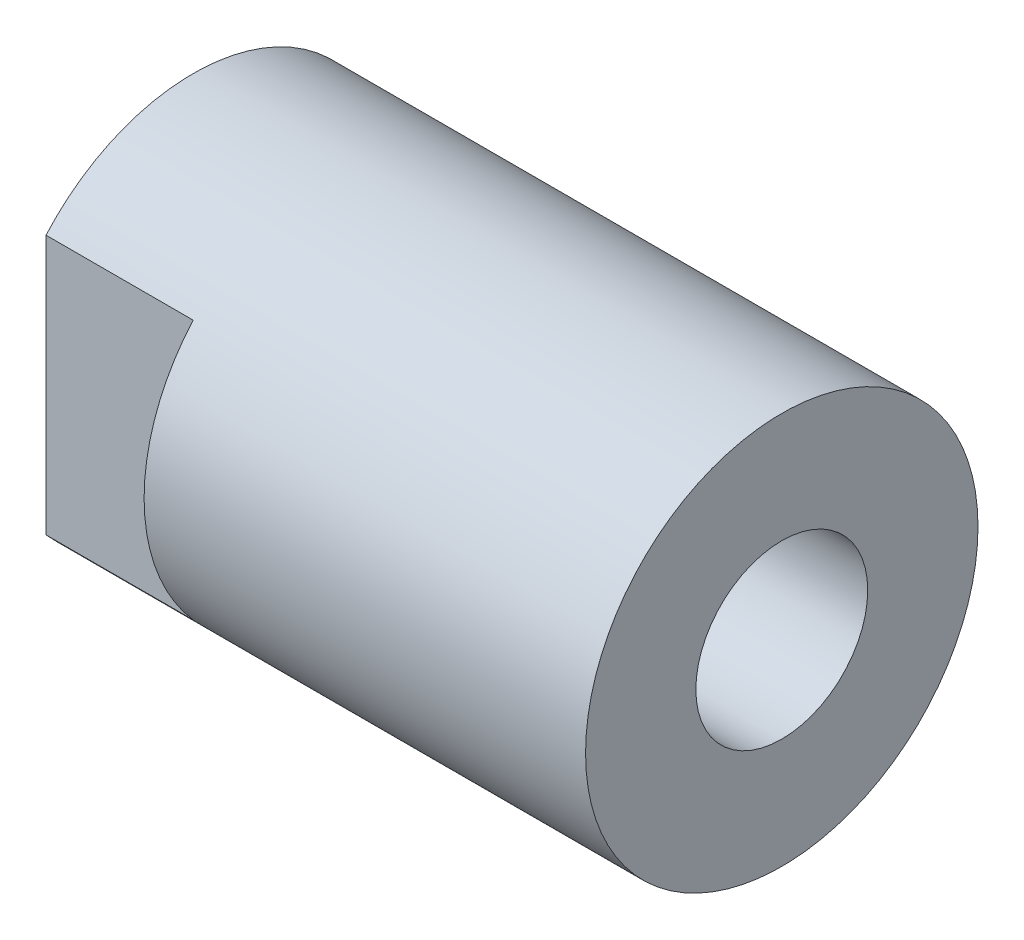
from build123d import *

# Parameters (mm, degrees)
CUT_EXTRUDE1_DEPTH = 9.525


with BuildPart() as part:
    # Sketch1 → Revolve1 (revolve)
    with BuildSketch(Plane.XY, mode=Mode.PRIVATE) as revolve1_sk:
        Polygon((0, 1.796034), (1.963185615, 1.27), (5.205360521, 1.27), (6.35, 3.175), (12.7, 3.175), (12.7, 5.5626), (38.1, 5.5626), (38.1, 12.7), (0, 12.7), align=None)
    revolve(revolve1_sk.sketch.rotate(Axis((0, 0, 0), (1, 0, 0)), 90), axis=Axis((0, 0, 0), (1, 0, 0)))

    # Sketch2 → Cut-Extrude1 (cut)
    with BuildSketch(Plane.ZY):
        with BuildLine():
            ThreePointArc((-9.525, 8.400260413), (-12.7, 0), (-9.525, -8.400260413))
            Line((-9.525, -8.400260413), (-9.525, 8.400260413))
        make_face()
        with BuildLine():
            Line((9.525, 8.400260413), (9.525, -8.400260413))
            ThreePointArc((9.525, -8.400260413), (11.879762203, -4.490128061), (12.7, 0))
            ThreePointArc((12.7, 0), (11.879762203, 4.490128061), (9.525, 8.400260413))
        make_face()
    extrude(amount=-CUT_EXTRUDE1_DEPTH, mode=Mode.SUBTRACT)


solid = part.part
